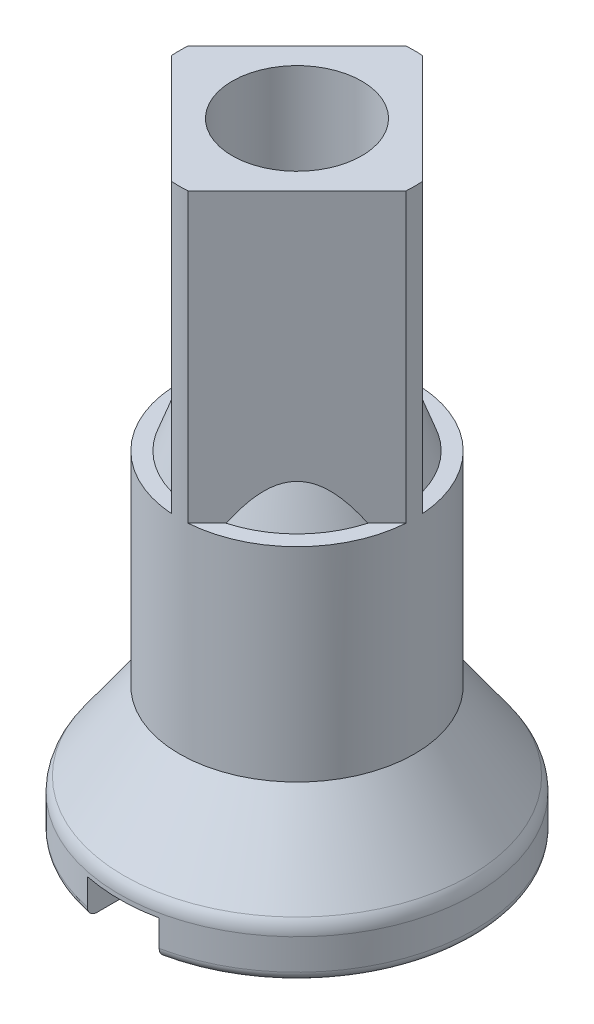
from build123d import *

# Parameters (mm, degrees)
SKETCH2_OUTSIDE_W = 12.738
SKETCH2_OUTSIDE_H = 12.738
EXTRUDE1_DEPTH    = 6
SKETCH3_R         = 2.125
EXTRUDE2_DEPTH    = 2
EXTRUDE2_TAPER    = 20
SKETCH4_R         = 1.35
EXTRUDE3_DEPTH    = 12
SKETCH5_W         = 1.5
SKETCH5_H         = 7.5
EXTRUDE4_DEPTH    = 0.75


with BuildPart() as part:
    # Sketch1 → Revolve1 (revolve)
    with BuildSketch(Plane.XY, mode=Mode.PRIVATE) as revolve1_sk:
        with BuildLine():
            Line((-6.597555333, -81.619969832), (-4.417555333, -81.619969832))
            ThreePointArc((-4.417555333, -81.619969832), (-4.276133977, -81.561391188), (-4.217555333, -81.419969832))
            Line((-4.217555333, -81.419969832), (-4.217555333, -80.780202359))
            ThreePointArc((-4.217555333, -80.780202359), (-4.241407579, -80.627613643), (-4.310688598, -80.489583262))
            Line((-4.310688598, -80.489583262), (-5.467555333, -78.869969832))
            Line((-5.467555333, -78.869969832), (-5.467555333, -72.569969832))
            Line((-5.467555333, -72.569969832), (-5.467555333, -68.619969832))
            Line((-5.467555333, -68.619969832), (-6.597555333, -68.619969832))
            Line((-6.597555333, -68.619969832), (-6.597555333, -81.619969832))
        make_face()
    revolve(revolve1_sk.sketch.rotate(Axis((-7.917555333, -68.619969832, 0), (0, -1, 0)), 180), axis=Axis((-7.917555333, -68.619969832, 0), (0, -1, 0)))

    # Sketch2 outside → Extrude1 (cut)
    with BuildSketch(Plane(origin=(0, -68.619969832, 0), x_dir=(-1, 0, 0), z_dir=(0, 1, 0))):
        with Locations((7.918, 0)):
            Rectangle(SKETCH2_OUTSIDE_W, SKETCH2_OUTSIDE_H)
        Polygon((5.301260243, 0), (7.917555333, -2.61629509), (10.533850424, 0), (7.917555333, 2.61629509), align=None, mode=Mode.SUBTRACT)
    extrude(amount=-EXTRUDE1_DEPTH, mode=Mode.SUBTRACT)

    # Sketch3 → Extrude2 (add)
    with BuildSketch(Plane(origin=(0, -74.619969832, 0), x_dir=(-1, 0, 0), z_dir=(0, 1, 0))):
        with Locations((7.917555333, 0)):
            Circle(SKETCH3_R)
    extrude(amount=EXTRUDE2_DEPTH, taper=EXTRUDE2_TAPER)

    # Sketch4 → Extrude3 (cut)
    with BuildSketch(Plane(origin=(0, -68.619969832, 0), x_dir=(-1, 0, 0), z_dir=(0, 1, 0))):
        with Locations((7.917555333, 0)):
            Circle(SKETCH4_R)
    extrude(amount=-EXTRUDE3_DEPTH, mode=Mode.SUBTRACT)

    # Sketch5 → Extrude4 (cut)
    with BuildSketch(Plane.XZ.offset(81.619969832)):
        with Locations((-7.917555333, 0)):
            Rectangle(SKETCH5_W, SKETCH5_H)
    extrude(amount=-EXTRUDE4_DEPTH, mode=Mode.SUBTRACT)


solid = part.part
